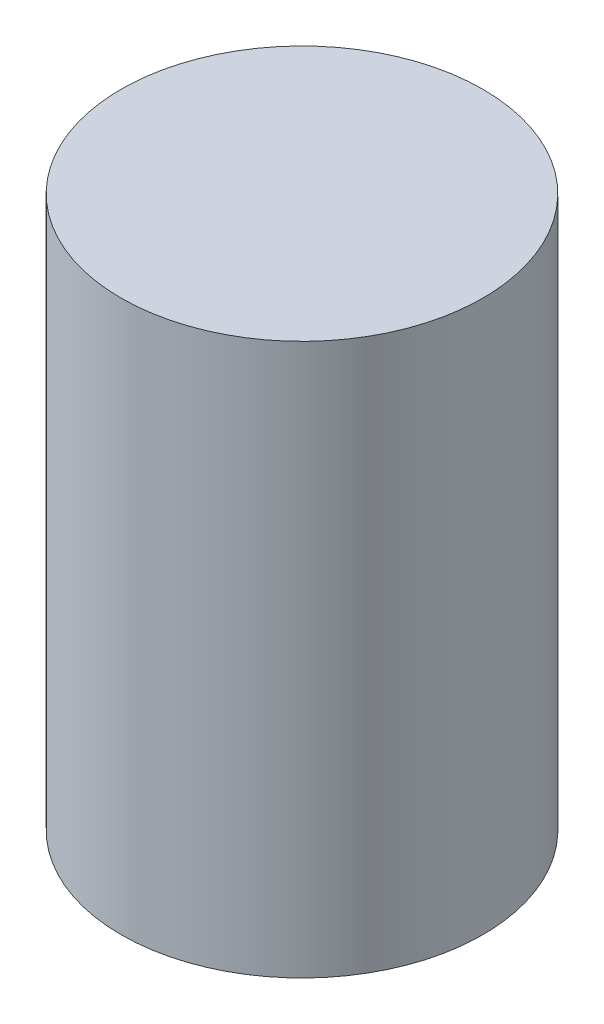
from build123d import *

# Parameters (mm, degrees)
SKETCH1_R           = 6.25
BOSS_EXTRUDE1_DEPTH = 19.05


with BuildPart() as part:
    # Sketch1 → Boss-Extrude1 (new body)
    with BuildSketch(Plane(origin=(0, 0, 0), x_dir=(1, 0, 0), z_dir=(0, 1, 0))):
        with Locations(Location((0, 0, 0), (0, 0, 90))):
            Circle(SKETCH1_R)
    extrude(amount=BOSS_EXTRUDE1_DEPTH)


solid = part.part
